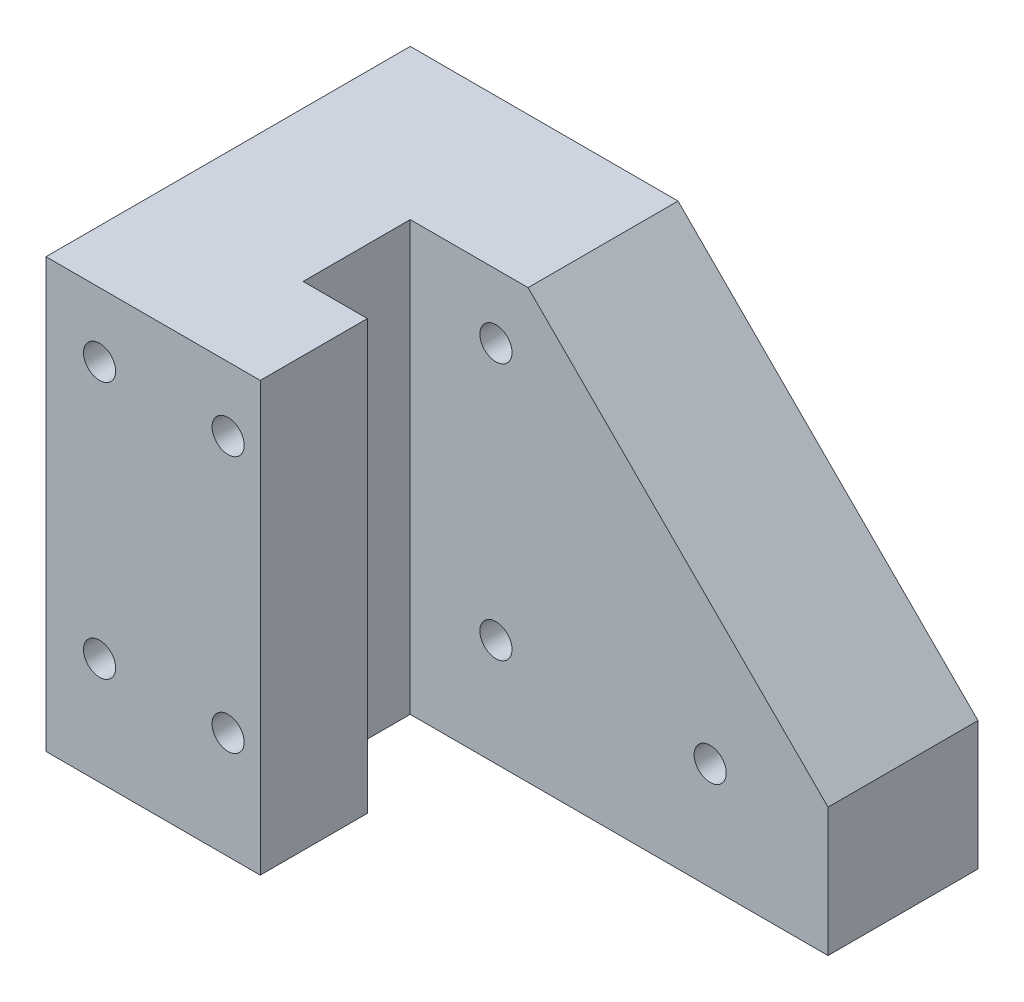
from build123d import *

# Parameters (mm, degrees)
SKETCH_1_W          = 20
SKETCH_1_H          = 40
EXTRUDE_1_DEPTH     = 34
SKETCH_2_R          = 1.5
CUT_EXTRUDE_1_DEPTH = 57.178287621
EXTRUDE_START       = -34
SKETCH_3_W          = 33
SKETCH_3_H          = 40
EXTRUDE_2_DEPTH     = 14
CUT_EXTRUDE_2_DEPTH = 75.598927606
SKETCH_5_R          = 1.5
CUT_EXTRUDE_3_DEPTH = 75.598927606
SKETCH_6_W          = 6
SKETCH_6_H          = 10
CUT_EXTRUDE_4_DEPTH = 75.598927606
SKETCH_7_R          = 1.5
CUT_EXTRUDE_5_DEPTH = 10


with BuildPart() as part:
    # 草图1 → 凸台-拉伸1 (new body)
    with BuildSketch(Plane.XY):
        with Locations((10, 20)):
            Rectangle(SKETCH_1_W, SKETCH_1_H)
    extrude(amount=EXTRUDE_1_DEPTH)

    # 草图2 → 切除-拉伸1 (cut, through all)
    with BuildSketch(Plane.XY.offset(34)):
        with Locations((5, 34)):
            Circle(SKETCH_2_R)
        with Locations((5, 10)):
            Circle(SKETCH_2_R)
    extrude(amount=-CUT_EXTRUDE_1_DEPTH, mode=Mode.SUBTRACT)

    # 草图3 → 凸台-拉伸2 (add)
    with BuildSketch(Plane.XY.offset(34).offset(EXTRUDE_START)):
        with Locations((36.5, 20)):
            Rectangle(SKETCH_3_W, SKETCH_3_H)
    extrude(amount=EXTRUDE_2_DEPTH)

    # 草图4 → 切除-拉伸2 (cut, through all)
    with BuildSketch(Plane(origin=(0, 0, 0), x_dir=(-1, 0, 0), z_dir=(0, 0, -1))):
        Polygon((-25, 40), (-53, 40), (-53, 12), align=None)
    extrude(amount=-CUT_EXTRUDE_2_DEPTH, mode=Mode.SUBTRACT)

    # 草图5 → 切除-拉伸3 (cut, through all)
    with BuildSketch(Plane(origin=(0, 0, 0), x_dir=(-1, 0, 0), z_dir=(0, 0, -1))):
        with Locations((-22, 34)):
            Circle(SKETCH_5_R)
        with Locations((-22, 10)):
            Circle(SKETCH_5_R)
        with Locations((-42, 10)):
            Circle(SKETCH_5_R)
    extrude(amount=-CUT_EXTRUDE_3_DEPTH, mode=Mode.SUBTRACT)

    # 草图6 → 切除-拉伸4 (cut, through all)
    with BuildSketch(Plane.XZ):
        with Locations((17, 19)):
            Rectangle(SKETCH_6_W, SKETCH_6_H)
    extrude(amount=-CUT_EXTRUDE_4_DEPTH, mode=Mode.SUBTRACT)

    # 草图7 → 切除-拉伸5 (cut)
    with BuildSketch(Plane.XY.offset(34)):
        with Locations((17, 34)):
            Circle(SKETCH_7_R)
        with Locations((17, 10)):
            Circle(SKETCH_7_R)
    extrude(amount=-CUT_EXTRUDE_5_DEPTH, mode=Mode.SUBTRACT)


solid = part.part
